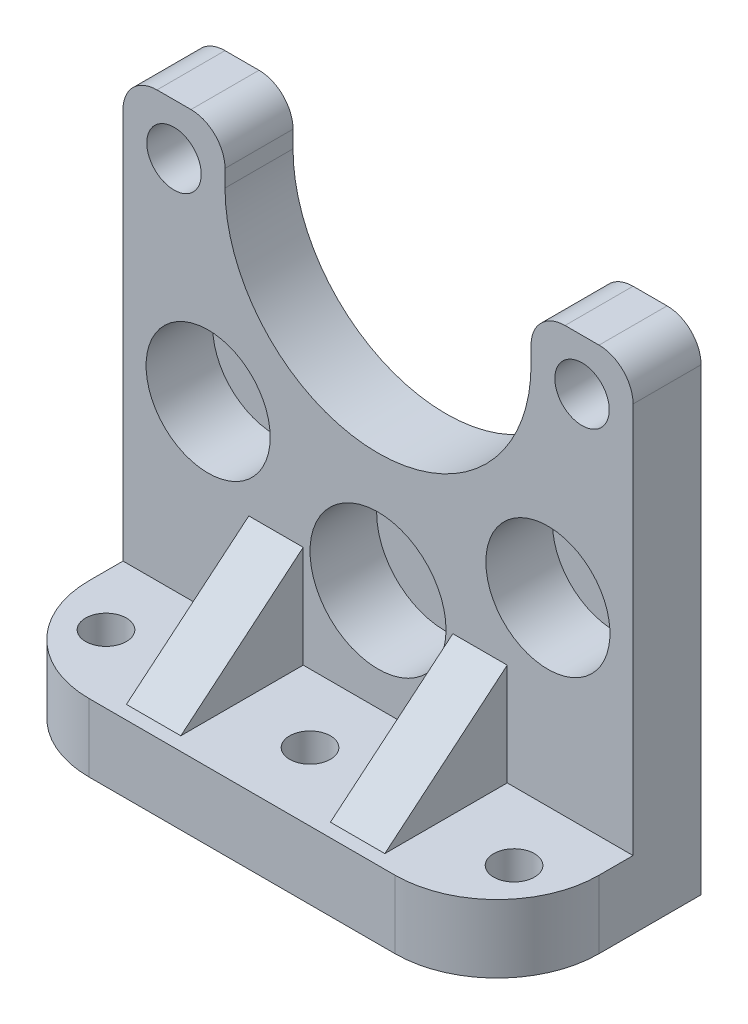
from build123d import *

# Parameters (mm, degrees)
SKETCH1_W           = 75
SKETCH1_H           = 72.5
BOSS_EXTRUDE1_DEPTH = 10
CUT_EXTRUDE1_DEPTH  = 10
SKETCH3_W           = 75
SKETCH3_H           = 10
FEET_DEPTH          = 20
SKETCH4_R           = 3
FEET_HOLE_DEPTH     = 10
SKETCH6_W           = 8
SKETCH6_H           = 15
BOSS_EXTRUDE2_DEPTH = 18
CUT_EXTRUDE2_DEPTH  = 97.687641403
SKETCH5_R           = 4
SKETCH5_R_2         = 10
SKETCH5_R_3         = 9.124733902
CUT_EXTRUDE3_DEPTH  = 9.8
FILLET1_R           = 5
FILLET2_R           = 15


with BuildPart() as part:
    # Sketch1 → Boss-Extrude1 (new body)
    with BuildSketch(Plane.XY):
        with Locations((37.5, 36.25)):
            Rectangle(SKETCH1_W, SKETCH1_H)
    extrude(amount=BOSS_EXTRUDE1_DEPTH)

    # Sketch2 → Cut-Extrude1 (cut)
    with BuildSketch(Plane.XY.offset(10)):
        with BuildLine():
            Line((60, 65), (60, 72.5))
            Line((60, 72.5), (15, 72.5))
            Line((15, 72.5), (15, 65))
            ThreePointArc((15, 65), (37.5, 42.5), (60, 65))
        make_face()
    extrude(amount=-CUT_EXTRUDE1_DEPTH, mode=Mode.SUBTRACT)

    # Sketch3 → feet (add)
    with BuildSketch(Plane.XY.offset(10)):
        with Locations((37.5, 5)):
            Rectangle(SKETCH3_W, SKETCH3_H)
    extrude(amount=FEET_DEPTH)

    # Sketch4 → feet-hole (cut)
    with BuildSketch(Plane.XZ):
        with Locations(Location((7.5, 20, 0), (0, 0, 270))):
            Circle(SKETCH4_R)
        with Locations(Location((67.5, 20, 0), (0, 0, 270))):
            Circle(SKETCH4_R)
        with Locations(Location((37.5, 20, 0), (0, 0, 270))):
            Circle(SKETCH4_R)
    extrude(amount=-FEET_HOLE_DEPTH, mode=Mode.SUBTRACT)

    # Sketch6 → Boss-Extrude2 (add)
    with BuildSketch(Plane.XY.offset(10)):
        with Locations((22.5, 17.5)):
            Rectangle(SKETCH6_W, SKETCH6_H)
        with Locations((52.5, 17.5)):
            Rectangle(SKETCH6_W, SKETCH6_H)
    extrude(amount=BOSS_EXTRUDE2_DEPTH)

    # Sketch7 → Cut-Extrude2 (cut, through all)
    with BuildSketch(Plane.ZY.offset(-18.5)):
        Polygon((10, 25), (28, 10), (28, 25), align=None)
    extrude(amount=-CUT_EXTRUDE2_DEPTH, mode=Mode.SUBTRACT)

    # Sketch5 → Cut-Extrude3 (cut)
    with BuildSketch(Plane.XY.offset(10)):
        with Locations((7.5, 65)):
            Circle(SKETCH5_R)
        with Locations(Location((67.5, 65, 0), (0, 0, 180))):
            Circle(SKETCH5_R)
        with Locations((37.5, 25)):
            Circle(SKETCH5_R_2)
        with Locations((12.51923423, 36.579255476)):
            Circle(SKETCH5_R_3)
        with Locations(Location((62.48076577, 36.579255476, 0), (0, 0, 180))):
            Circle(SKETCH5_R_3)
    extrude(amount=-CUT_EXTRUDE3_DEPTH, mode=Mode.SUBTRACT)

    # Fillet1
    fillet1_edges = [part.edges().sort_by_distance(p)[0] for p in [
        (0, 72.5, 5),
        (15, 72.5, 5),
        (60, 72.5, 5),
        (75, 72.5, 5),
    ]]
    fillet(fillet1_edges, radius=FILLET1_R)

    # Fillet2
    fillet2_edges = [part.edges().sort_by_distance(p)[0] for p in [
        (0, 5, 30),
        (75, 5, 30),
    ]]
    fillet(fillet2_edges, radius=FILLET2_R)


solid = part.part
